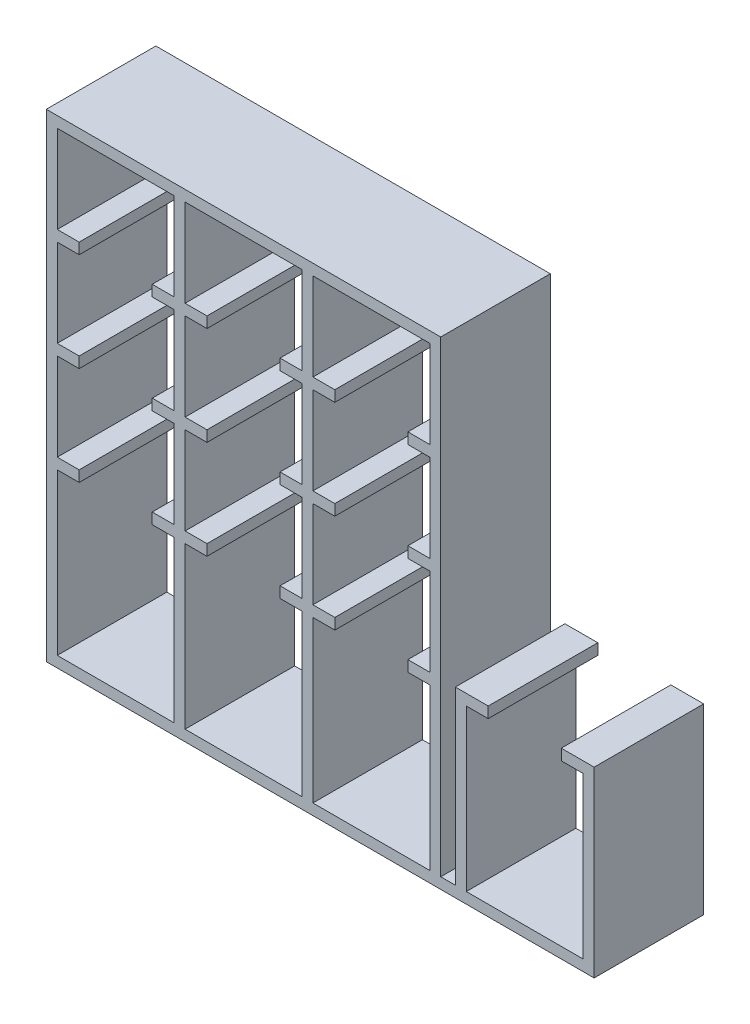
from build123d import *

# Parameters (mm, degrees)
BOSS_EXTRUDE1_DEPTH   = 150
BOSS_EXTRUDE2_DEPTH   = 150
BOSS_EXTRUDE2_2_DEPTH = 150
SKETCH3_W             = 750
SKETCH3_H             = 15
BOSS_EXTRUDE3_DEPTH   = 150


with BuildPart() as part:
    # Sketch1 → Boss-Extrude1 (new body)
    with BuildSketch(Plane.XY):
        Polygon((0, 640), (540, 640), (540, 0), (525, 0), (525, 220), (495, 220), (495, 235), (525, 235), (525, 355), (495, 355), (495, 370), (525, 370), (525, 490), (495, 490), (495, 505), (525, 505), (525, 625), (365, 625), (365, 505), (395, 505), (395, 490), (365, 490), (365, 370), (395, 370), (395, 355), (365, 355), (365, 235), (395, 235), (395, 220), (365, 220), (365, 0), (350, 0), (350, 220), (320, 220), (320, 235), (350, 235), (350, 355), (320, 355), (320, 370), (350, 370), (350, 490), (320, 490), (320, 505), (350, 505), (350, 625), (190, 625), (190, 505), (220, 505), (220, 490), (190, 490), (190, 370), (220, 370), (220, 355), (190, 355), (190, 235), (220, 235), (220, 220), (190, 220), (190, 0), (175, 0), (175, 220), (145, 220), (145, 235), (175, 235), (175, 355), (145, 355), (145, 370), (175, 370), (175, 490), (145, 490), (145, 505), (175, 505), (175, 625), (15, 625), (15, 505), (45, 505), (45, 490), (15, 490), (15, 370), (45, 370), (45, 355), (15, 355), (15, 235), (45, 235), (45, 220), (15, 220), (15, 0), (0, 0), align=None)
    extrude(amount=BOSS_EXTRUDE1_DEPTH)



with BuildPart() as body_2:
    # Sketch2 → Boss-Extrude2 (new body)
    with BuildSketch(Plane.XY):
        Polygon((560, 235), (605, 235), (605, 220), (575, 220), (575, 0), (560, 0), align=None)
    extrude(amount=BOSS_EXTRUDE2_DEPTH)


with BuildPart() as body_3:
    # Sketch2 → Boss-Extrude2 2 (new body)
    with BuildSketch(Plane.XY):
        Polygon((735, 0), (735, 220), (705, 220), (705, 235), (750, 235), (750, 0), align=None)
    extrude(amount=BOSS_EXTRUDE2_2_DEPTH)


with BuildPart() as part_1:
    add(part.part)

    add(body_2.part)  # Boss-Extrude3 merges body 2

    add(body_3.part)  # Boss-Extrude3 merges body 3
    # Sketch3 → Boss-Extrude3 (add)
    with BuildSketch(Plane.XY.offset(150)):
        with Locations((375, -7.5)):
            Rectangle(SKETCH3_W, SKETCH3_H)
    extrude(amount=-BOSS_EXTRUDE3_DEPTH)


solid = part_1.part
